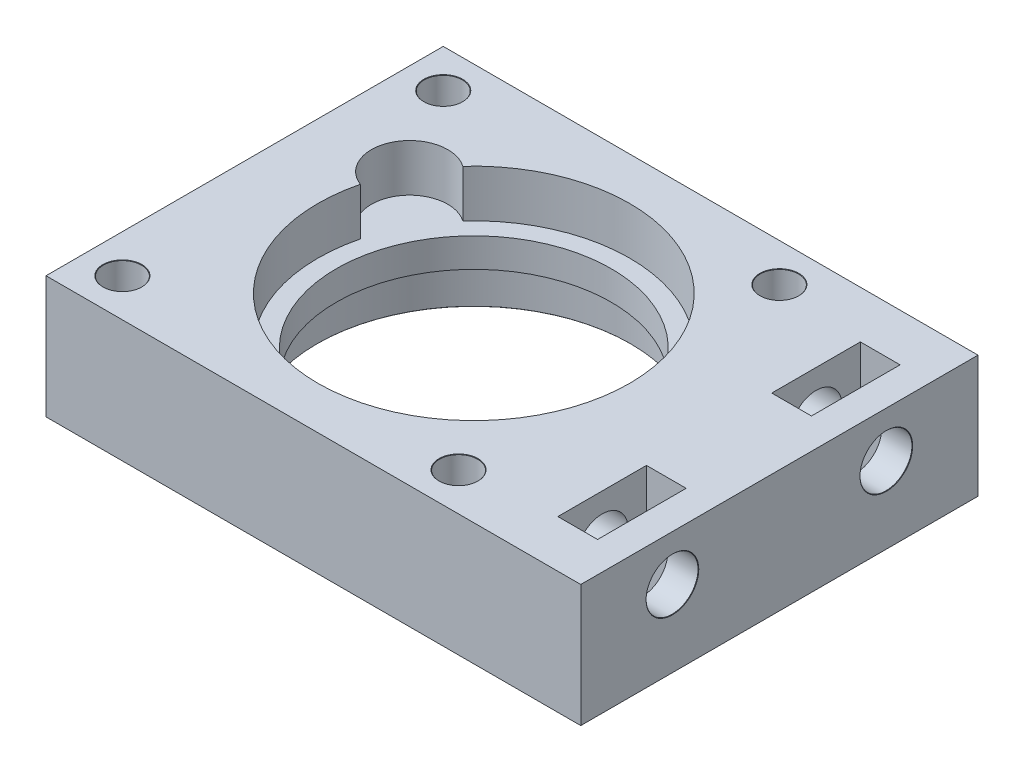
from build123d import *

# Parameters (mm, degrees)
SKETCH1_W                             = 35
SKETCH1_H                             = 26
BOSS_EXTRUDE1_DEPTH                   = 8
M3_CLEARANCE_HOLE1_D                  = 3.4
M3_CLEARANCE_HOLE1_DEPTH              = 8
M3_CLEARANCE_HOLE1_CSINK_D            = 3.45
M3_CLEARANCE_HOLE1_CSINK_ANGLE        = 90
M3_CLEARANCE_HOLE1_TIP                = 1.021463052
SKETCH6_R                             = 10.2
CUT_EXTRUDE1_DEPTH                    = 3.1
SKETCH7_R                             = 9
CUT_EXTRUDE2_DEPTH                    = 44.874935897
SKETCH8_R                             = 2.5
CUT_EXTRUDE3_DEPTH                    = 3.1
TAP_DRILL_FOR_M3X0_5_TAP1_D           = 2.5
TAP_DRILL_FOR_M3X0_5_TAP1_CSINK_D     = 2.55
TAP_DRILL_FOR_M3X0_5_TAP1_CSINK_ANGLE = 90
SKETCH11_W                            = 2.6
SKETCH11_H                            = 5.8
CUT_EXTRUDE4_DEPTH                    = 45.328320519


with BuildPart() as part:
    # Sketch1 → Boss-Extrude1 (new body)
    with BuildSketch(Plane(origin=(0, 0, 0), x_dir=(1, 0, 0), z_dir=(0, 1, 0))):
        with Locations((17.5, 13)):
            Rectangle(SKETCH1_W, SKETCH1_H)
    extrude(amount=BOSS_EXTRUDE1_DEPTH)

    # M3 Clearance Hole1
    with Locations(Plane(origin=(35, 0, 0), x_dir=(0, 0, -1), z_dir=(1, 0, 0))):
        with Locations((6, 5), (20, 5)):
            CounterSinkHole(M3_CLEARANCE_HOLE1_D / 2, M3_CLEARANCE_HOLE1_CSINK_D / 2, depth=M3_CLEARANCE_HOLE1_DEPTH, counter_sink_angle=M3_CLEARANCE_HOLE1_CSINK_ANGLE)
            with Locations((0, 0, -(M3_CLEARANCE_HOLE1_DEPTH + M3_CLEARANCE_HOLE1_TIP / 2))):  # 118° drill point
                Cone(0, M3_CLEARANCE_HOLE1_D / 2, M3_CLEARANCE_HOLE1_TIP, mode=Mode.SUBTRACT)

    # Sketch5 → Tap Drill for M22x1.5 Tap1 (revolve, cut)
    with BuildSketch(Plane(origin=(15, 0, -13), x_dir=(0, 0, -1), z_dir=(1, 0, 0))):
        Polygon((0, 0), (0, 3), (10.25, 3), (10.25, 0.025), (10.275, 0), align=None)
    revolve(axis=Axis((15, -6.35, -13), (0, 1, 0)), mode=Mode.SUBTRACT)

    # Sketch6 → Cut-Extrude1 (cut)
    with BuildSketch(Plane(origin=(0, 8, 0), x_dir=(1, 0, 0), z_dir=(0, 1, 0))):
        with Locations(Location((15, 13, 0), (0, 0, 270))):
            Circle(SKETCH6_R)
    extrude(amount=-CUT_EXTRUDE1_DEPTH, mode=Mode.SUBTRACT)

    # Sketch7 → Cut-Extrude2 (cut, through all)
    with BuildSketch(Plane(origin=(0, 4.9, 0), x_dir=(1, 0, 0), z_dir=(0, 1, 0))):
        with Locations(Location((15, 13, 0), (0, 0, 270))):
            Circle(SKETCH7_R)
    extrude(amount=-CUT_EXTRUDE2_DEPTH, mode=Mode.SUBTRACT)

    # Sketch8 → Cut-Extrude3 (cut)
    with BuildSketch(Plane(origin=(0, 8, 0), x_dir=(1, 0, 0), z_dir=(0, 1, 0))):
        with Locations((6, 17.8)):
            Circle(SKETCH8_R)
    extrude(amount=-CUT_EXTRUDE3_DEPTH, mode=Mode.SUBTRACT)

    # Tap Drill for M3x0.5 Tap1 (through all)
    with Locations(Plane(origin=(0, 8, 0), x_dir=(1, 0, 0), z_dir=(0, 1, 0))):
        with Locations((2.5, 23.5), (24.5, 23.5), (24.5, 2.5), (2.5, 2.5)):
            CounterSinkHole(TAP_DRILL_FOR_M3X0_5_TAP1_D / 2, TAP_DRILL_FOR_M3X0_5_TAP1_CSINK_D / 2, counter_sink_angle=TAP_DRILL_FOR_M3X0_5_TAP1_CSINK_ANGLE)

    # Sketch11 → Cut-Extrude4 (cut, through all)
    with BuildSketch(Plane(origin=(0, 8, 0), x_dir=(1, 0, 0), z_dir=(0, 1, 0))):
        with Locations((31.7, 6)):
            Rectangle(SKETCH11_W, SKETCH11_H)
        with Locations((31.7, 20)):
            Rectangle(SKETCH11_W, SKETCH11_H)
    extrude(amount=-CUT_EXTRUDE4_DEPTH, mode=Mode.SUBTRACT)


solid = part.part
